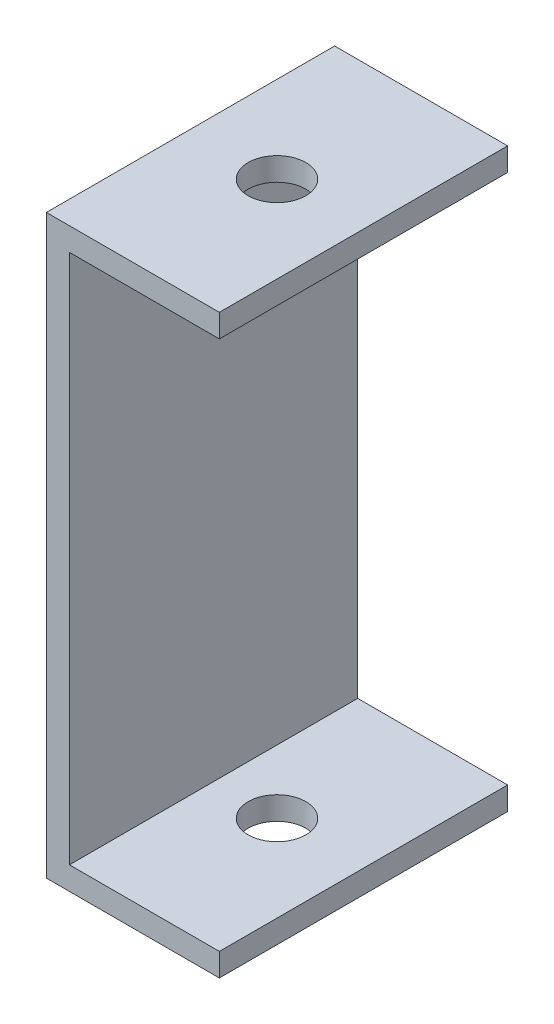
from build123d import *

# Parameters (mm, degrees)
SALIENTE_EXTRUIR1_DEPTH = 25
CROQUIS2_R              = 2.5
CORTAR_EXTRUIR1_DEPTH   = 58.879184514


with BuildPart() as part:
    # Croquis1 → Saliente-Extruir1 (new body)
    with BuildSketch(Plane.XY):
        Polygon((15, 0), (0, 0), (0, 50), (15, 50), (15, 48), (2, 48), (2, 2), (15, 2), align=None)
    extrude(amount=SALIENTE_EXTRUIR1_DEPTH)

    # Croquis2 → Cortar-Extruir1 (cut, through all)
    with BuildSketch(Plane(origin=(0, 50, 0), x_dir=(1, 0, 0), z_dir=(0, 1, 0))):
        with Locations(Location((7.5, -12.5, 0), (0, 0, 270))):
            Circle(CROQUIS2_R)
    extrude(amount=-CORTAR_EXTRUIR1_DEPTH, mode=Mode.SUBTRACT)


solid = part.part
